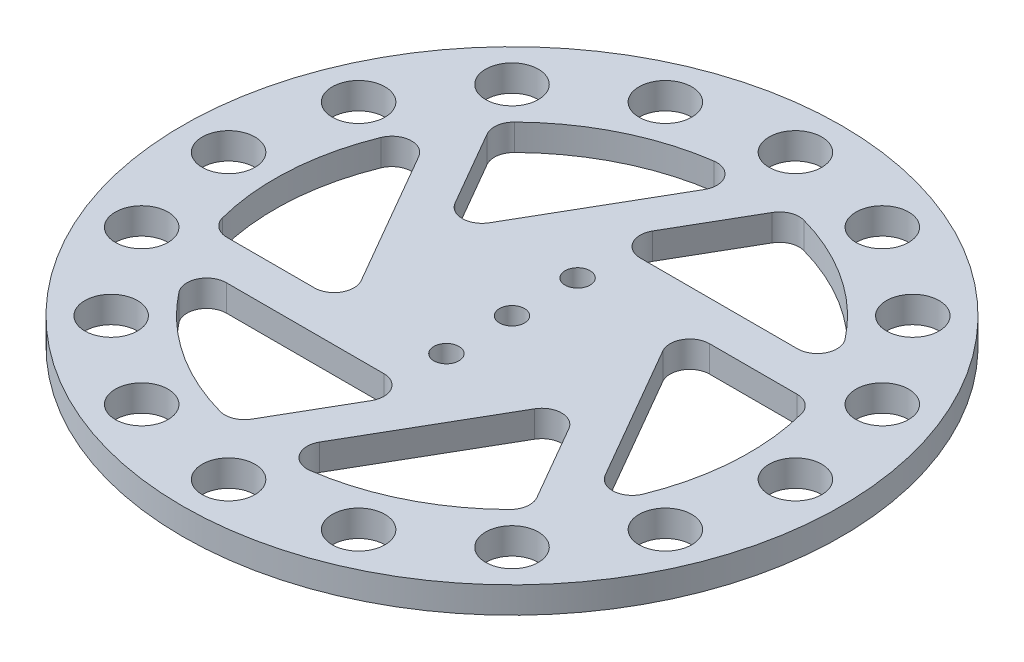
from build123d import *

# Parameters (mm, degrees)
SKETCH1_R           = 50
BOSS_EXTRUDE1_DEPTH = 4
SKETCH2_R           = 4
CUT_EXTRUDE1_DEPTH  = 4
CIRPATTERN1_COUNT   = 16
CUT_EXTRUDE2_DEPTH  = 4
CIRPATTERN3_COUNT   = 6
SKETCH5_R           = 1.9
CUT_EXTRUDE3_DEPTH  = 4


with BuildPart() as part:
    # Sketch1 → Boss-Extrude1 (new body)
    with BuildSketch(Plane(origin=(0, 0, 0), x_dir=(1, 0, 0), z_dir=(0, 1, 0))):
        with Locations(Location((0, 0, 0), (0, 0, 270))):
            Circle(SKETCH1_R)
    extrude(amount=BOSS_EXTRUDE1_DEPTH)

    # Sketch2 → Cut-Extrude1 (cut)
    with BuildSketch(Plane(origin=(0, 4, 0), x_dir=(1, 0, 0), z_dir=(0, 1, 0))):
        with Locations(Location((0, 43, 0), (0, 0, 270))):
            Circle(SKETCH2_R)
    cut_extrude1 = extrude(amount=-CUT_EXTRUDE1_DEPTH, mode=Mode.SUBTRACT)

    # CirPattern1: Cut-Extrude1 ×16 about axis
    cirpattern1_axis = Axis((0, 0, 0), (0, 1, 0))
    for i in range(1, CIRPATTERN1_COUNT):
        add(cut_extrude1.rotate(cirpattern1_axis, i * 360 / CIRPATTERN1_COUNT), mode=Mode.SUBTRACT)

    # Sketch3 → Cut-Extrude2 (cut)
    with BuildSketch(Plane(origin=(0, 4, 0), x_dir=(1, 0, 0), z_dir=(0, 1, 0))):
        with BuildLine():
            Line((2.124355653, 17.320508076), (10, 17.320508076))
            Line((10, 17.320508076), (26.001479795, 17.320508076))
            ThreePointArc((26.001479795, 17.320508076), (28.697954971, 19.005585406), (28.365250686, 22.167826992))
            ThreePointArc((28.365250686, 22.167826992), (19.971239607, 29.952455468), (9.557608221, 34.70809884))
            ThreePointArc((9.557608221, 34.70809884), (7.622675946, 34.591346868), (6.163064658, 33.31575727))
            Line((6.163064658, 33.31575727), (-0.473720558, 21.820508076))
            ThreePointArc((-0.473720558, 21.820508076), (-0.473720558, 18.820508076), (2.124355653, 17.320508076))
        make_face()
    cut_extrude2 = extrude(amount=-CUT_EXTRUDE2_DEPTH, mode=Mode.SUBTRACT)

    # CirPattern3: Cut-Extrude2 ×6 about axis
    cirpattern3_axis = Axis((0, 0, 0), (0, 1, 0))
    for i in range(1, CIRPATTERN3_COUNT):
        add(cut_extrude2.rotate(cirpattern3_axis, i * 360 / CIRPATTERN3_COUNT), mode=Mode.SUBTRACT)

    # Sketch5 → Cut-Extrude3 (cut)
    with BuildSketch(Plane(origin=(0, 4, 0), x_dir=(1, 0, 0), z_dir=(0, 1, 0))):
        with Locations(Location((0, 9.95, 0), (0, 0, 270))):
            Circle(SKETCH5_R)
        with Locations(Location((0, 0, 0), (0, 0, 270))):
            Circle(SKETCH5_R)
        with Locations(Location((0, -9.95, 0), (0, 0, 270))):
            Circle(SKETCH5_R)
    extrude(amount=-CUT_EXTRUDE3_DEPTH, mode=Mode.SUBTRACT)


solid = part.part
